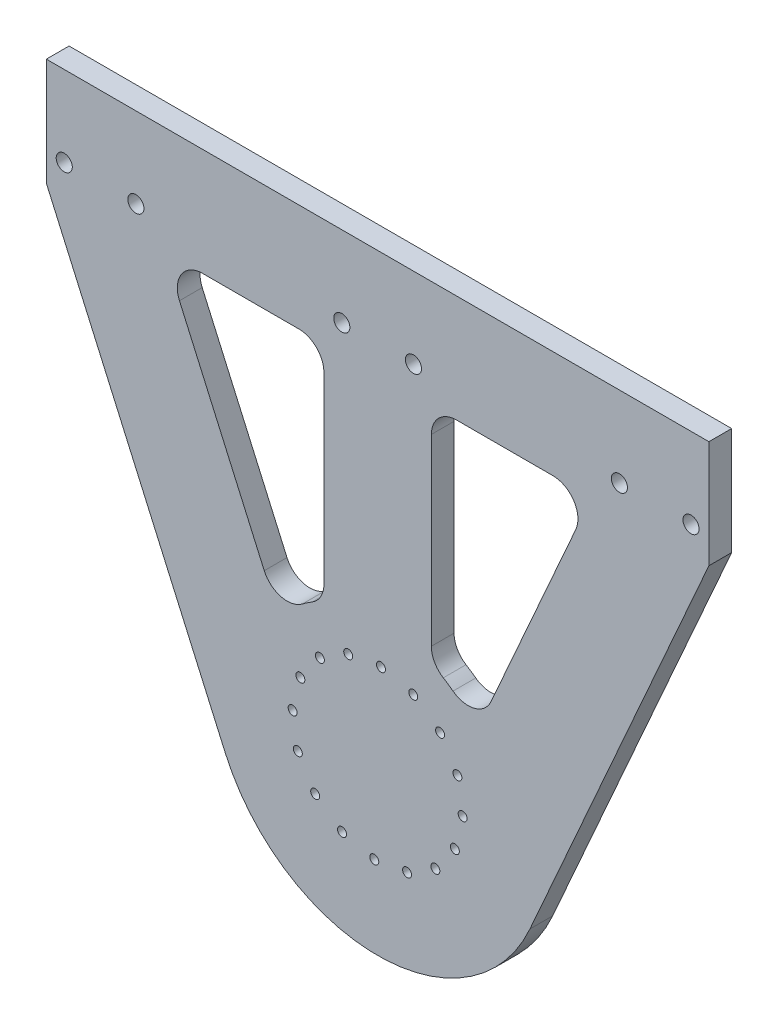
from build123d import *

# Parameters (mm, degrees)
BOSS_EXTRUDE1_DEPTH     = 3.175
CUT_EXTRUDE2_DEPTH      = 155.830786667
CUT_EXTRUDE2_DEPTH_BACK = 155.830786667
SKETCH3_R               = 1.25
SKETCH4_R               = 2.25
CUT_EXTRUDE3_DEPTH      = 155.830786667
CUT_EXTRUDE4_DEPTH      = 155.830786667
FILLET1_R               = 7


with BuildPart() as part:
    # Sketch1 → Boss-Extrude1 (new, symmetric)
    with BuildSketch(Plane.XY):
        with BuildLine():
            Line((92.5, 124), (-92.5, 124))
            Line((-92.5, 124), (-92.5, 94))
            Line((-92.5, 94), (-42.515070642, -18.833979089))
            ThreePointArc((-42.515070642, -18.833979089), (0, -46.5), (42.515070642, -18.833979089))
            Line((42.515070642, -18.833979089), (92.5, 94))
            Line((92.5, 94), (92.5, 124))
        make_face()
    extrude(amount=BOSS_EXTRUDE1_DEPTH, both=True)

    # Sketch3 → Cut-Extrude2 (cut, two sides: drawn at the far end of the back side and taken through both)
    with BuildSketch(Plane(origin=(0, 0, -3.175), x_dir=(-1, 0, 0), z_dir=(0, 0, -1)).offset(-CUT_EXTRUDE2_DEPTH_BACK)):
        with Locations((17.440159599, -16.121517706)):
            Circle(SKETCH3_R)
        with Locations((22.282044228, -8.220280106)):
            Circle(SKETCH3_R)
        with Locations((9.943168767, -21.568400378)):
            Circle(SKETCH3_R)
        with Locations((0.932420624, -23.731689611)):
            Circle(SKETCH3_R)
        with Locations((-8.220280106, -22.282044228)):
            Circle(SKETCH3_R)
        with Locations((-16.121517706, -17.440159599)):
            Circle(SKETCH3_R)
        with Locations((-21.568400378, -9.943168767)):
            Circle(SKETCH3_R)
        with Locations((-23.731689611, -0.932420624)):
            Circle(SKETCH3_R)
        with Locations((-22.282044228, 8.220280106)):
            Circle(SKETCH3_R)
        with Locations((-17.440159599, 16.121517706)):
            Circle(SKETCH3_R)
        with Locations((-9.943168767, 21.568400378)):
            Circle(SKETCH3_R)
        with Locations((-0.932420624, 23.731689611)):
            Circle(SKETCH3_R)
        with Locations((8.220280106, 22.282044228)):
            Circle(SKETCH3_R)
        with Locations((16.121517706, 17.440159599)):
            Circle(SKETCH3_R)
        with Locations((21.568400378, 9.943168767)):
            Circle(SKETCH3_R)
        with Locations((23.731689611, 0.932420624)):
            Circle(SKETCH3_R)
    extrude(amount=CUT_EXTRUDE2_DEPTH + CUT_EXTRUDE2_DEPTH_BACK, mode=Mode.SUBTRACT)

    # Sketch4 → Cut-Extrude3 (cut, through all)
    with BuildSketch(Plane(origin=(0, 0, -3.175), x_dir=(-1, 0, 0), z_dir=(0, 0, -1))):
        with Locations((67.5, 101.5)):
            Circle(SKETCH4_R)
        with Locations((87.5, 101.5)):
            Circle(SKETCH4_R)
        with Locations((-87.5, 101.5)):
            Circle(SKETCH4_R)
        with Locations((-67.5, 101.5)):
            Circle(SKETCH4_R)
        with Locations((-10, 101.5)):
            Circle(SKETCH4_R)
        with Locations((10, 101.5)):
            Circle(SKETCH4_R)
    extrude(amount=-CUT_EXTRUDE3_DEPTH, mode=Mode.SUBTRACT)

    # Sketch5 → Cut-Extrude4 (cut, through all)
    with BuildSketch(Plane(origin=(0, 0, -3.175), x_dir=(-1, 0, 0), z_dir=(0, 0, -1))):
        with BuildLine():
            Line((-15, 94), (-59.688105795, 94))
            Line((-59.688105795, 94), (-27.587967337, 21.538432121))
            ThreePointArc((-27.587967337, 21.538432121), (-21.882806981, 27.315613825), (-15, 31.622776602))
            Line((-15, 31.622776602), (-15, 94))
        make_face()
        with BuildLine():
            Line((59.688105795, 94), (27.587967337, 21.538432121))
            ThreePointArc((27.587967337, 21.538432121), (21.882806981, 27.315613825), (15, 31.622776602))
            Line((15, 31.622776602), (15, 94))
            Line((15, 94), (59.688105795, 94))
        make_face()
    extrude(amount=-CUT_EXTRUDE4_DEPTH, mode=Mode.SUBTRACT)

    # Fillet1
    fillet1_edges = [part.edges().sort_by_distance(p)[0] for p in [
        (-59.688105795, 94, 0),
        (-27.587967337, 21.538432121, 0),
        (-15, 31.622776602, 0),
        (-15, 94, 0),
        (15, 31.622776602, 0),
        (27.587967337, 21.538432121, 0),
        (15, 94, 0),
        (59.688105795, 94, 0),
    ]]
    fillet(fillet1_edges, radius=FILLET1_R)


solid = part.part
